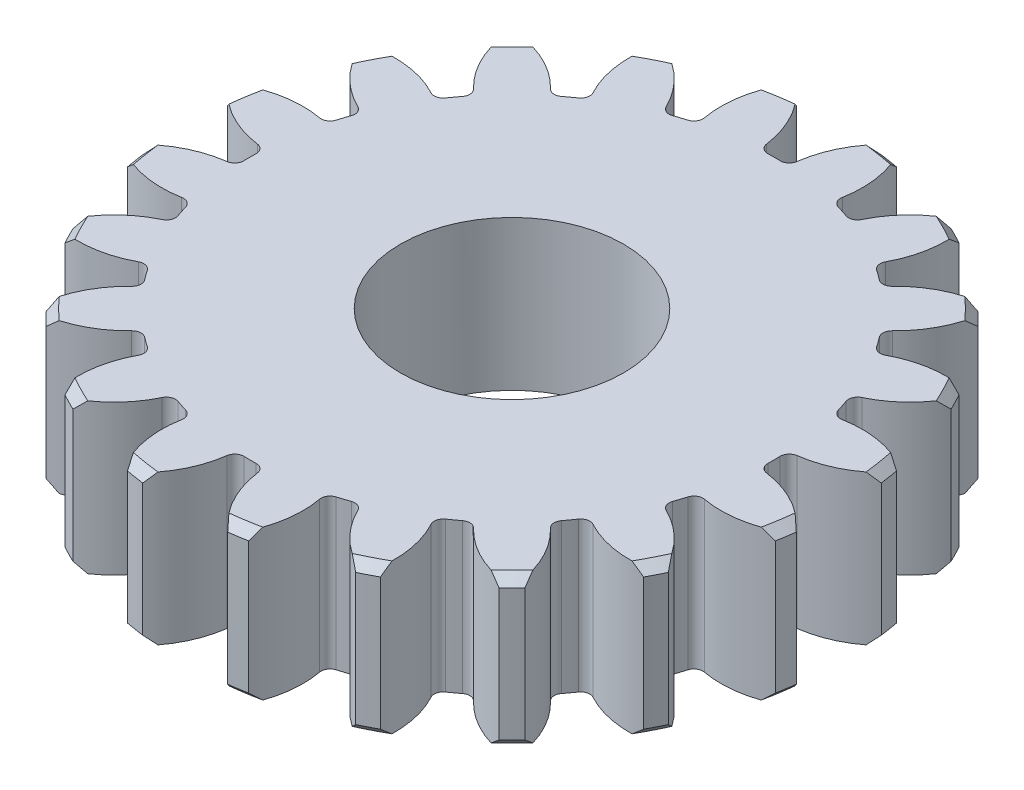
from build123d import *

# Parameters (mm, degrees)
SKETCH1_R                = 22
BOSS_EXTRUDE1_DEPTH      = 10
CUT_EXTRUDE1_DEPTH       = 10
FILLET1_R                = 0.6
CHAMFER1_SIZE            = 0.6
CIRPATTERN1_COUNT        = 20
FILLET1_OF_CIRPATTERN1_R = 0.6
SKETCH3_R                = 7.45
CUT_EXTRUDE2_DEPTH       = 10


with BuildPart() as part:
    # Sketch1 → Boss-Extrude1 (new body)
    with BuildSketch(Plane(origin=(0, 0, 0), x_dir=(1, 0, 0), z_dir=(0, 1, 0))):
        with Locations(Location((0, 0, 0), (0, 0, 270))):
            Circle(SKETCH1_R)
    extrude(amount=BOSS_EXTRUDE1_DEPTH)

    # Sketch2 → Cut-Extrude1 (cut)
    with BuildSketch(Plane.XZ):
        with BuildLine():
            ThreePointArc((-2.83665719, 21.816355699), (-1.513028297, 19.811754334), (-0.962550115, 17.473508442))
            ThreePointArc((-0.962550115, 17.473508442), (0, 17.5), (0.962550115, 17.473508442))
            ThreePointArc((0.962550115, 17.473508442), (1.513028297, 19.811754334), (2.83665719, 21.816355699))
            ThreePointArc((2.83665719, 21.816355699), (0, 22), (-2.83665719, 21.816355699))
        make_face()
    cut_extrude1 = extrude(amount=-CUT_EXTRUDE1_DEPTH, mode=Mode.SUBTRACT)

    # Fillet1
    fillet1_edges = [part.edges().sort_by_distance(p)[0] for p in [
        (-0.962550115, 5, 17.473508442),
        (0.962550115, 5, 17.473508442),
    ]]
    fillet(fillet1_edges, radius=FILLET1_R)

    # Chamfer1
    chamfer1_edges = [part.edges().sort_by_distance(p)[0] for p in [
        (0, 0, -22),
        (0, 10, -22),
    ]]
    chamfer(chamfer1_edges, length=CHAMFER1_SIZE)

    # CirPattern1: Cut-Extrude1 ×20 about axis
    cirpattern1_axis = Axis((0, 0, 0), (0, 1, 0))
    for i in range(1, CIRPATTERN1_COUNT):
        add(cut_extrude1.rotate(cirpattern1_axis, i * 360 / CIRPATTERN1_COUNT), mode=Mode.SUBTRACT)

    # Fillet1 of CirPattern1
    fillet1_of_cirpattern1_edges = [part.edges().sort_by_distance(p)[0] for p in [
        (4.4841715, 5, 16.91573841),
        (6.31505062, 5, 16.320849723),
        (9.491951167, 5, 14.702138043),
        (11.049389969, 5, 13.570592519),
        (13.570592519, 5, 11.049389969),
        (14.702138043, 5, 9.491951167),
        (16.320849723, 5, 6.31505062),
        (16.91573841, 5, 4.4841715),
        (17.473508442, 5, 0.962550115),
        (17.473508442, 5, -0.962550115),
        (16.91573841, 5, -4.4841715),
        (16.320849723, 5, -6.31505062),
        (14.702138043, 5, -9.491951167),
        (13.570592519, 5, -11.049389969),
        (11.049389969, 5, -13.570592519),
        (9.491951167, 5, -14.702138043),
        (6.31505062, 5, -16.320849723),
        (4.4841715, 5, -16.91573841),
        (0.962550115, 5, -17.473508442),
        (-0.962550115, 5, -17.473508442),
        (-4.4841715, 5, -16.91573841),
        (-6.31505062, 5, -16.320849723),
        (-9.491951167, 5, -14.702138043),
        (-11.049389969, 5, -13.570592519),
        (-13.570592519, 5, -11.049389969),
        (-14.702138043, 5, -9.491951167),
        (-16.320849723, 5, -6.31505062),
        (-16.91573841, 5, -4.4841715),
        (-17.473508442, 5, -0.962550115),
        (-17.473508442, 5, 0.962550115),
        (-16.91573841, 5, 4.4841715),
        (-16.320849723, 5, 6.31505062),
        (-14.702138043, 5, 9.491951167),
        (-13.570592519, 5, 11.049389969),
        (-11.049389969, 5, 13.570592519),
        (-9.491951167, 5, 14.702138043),
        (-6.31505062, 5, 16.320849723),
        (-4.4841715, 5, 16.91573841),
    ]]
    fillet(fillet1_of_cirpattern1_edges, radius=FILLET1_OF_CIRPATTERN1_R)

    # Sketch3 → Cut-Extrude2 (cut)
    with BuildSketch(Plane.XZ):
        with Locations(Location((0, 0, 0), (0, 0, 270))):
            Circle(SKETCH3_R)
    extrude(amount=-CUT_EXTRUDE2_DEPTH, mode=Mode.SUBTRACT)


solid = part.part
